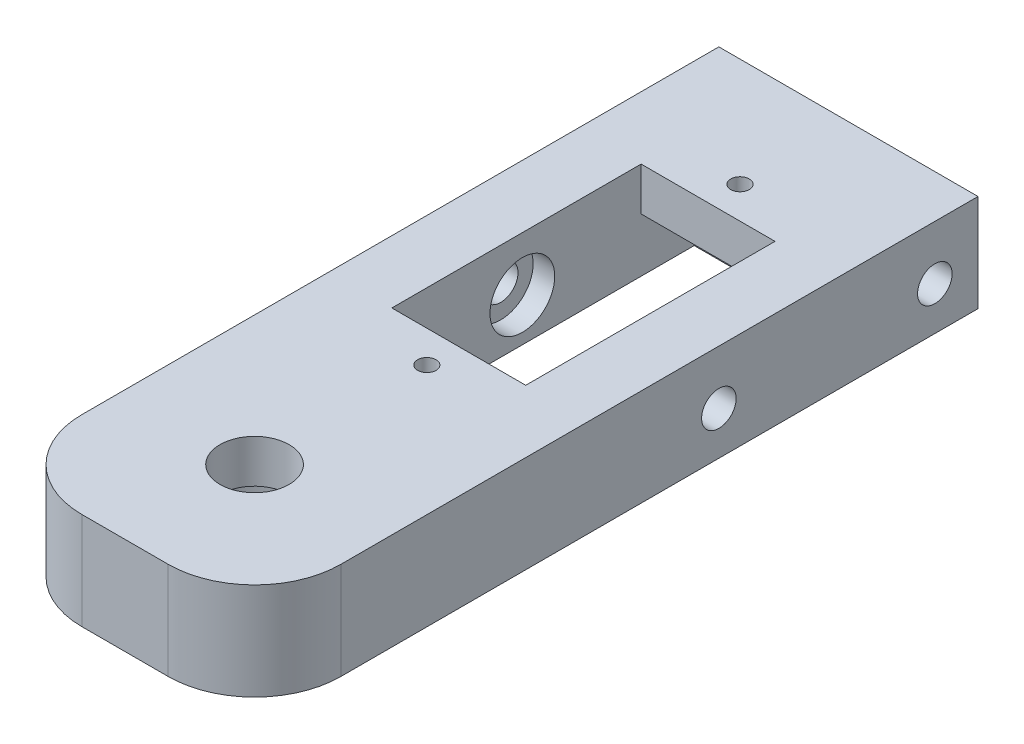
from build123d import *

# Parameters (mm, degrees)
SKETCH_1_W          = 67
SKETCH_1_H          = 9
EXTRUDE_1_DEPTH     = 12
SKETCH_2_R          = 6.7
CUT_EXTRUDE_1_DEPTH = 5
SKETCH_4_R          = 3.2
CUT_EXTRUDE_3_DEPTH = 57.515484604
SKETCH_3_W          = 12.4
SKETCH_3_H          = 23.085257288
CUT_EXTRUDE_2_DEPTH = 58.008771255
SKETCH_5_W          = 12.4
SKETCH_5_H          = 32.914742712
CUT_EXTRUDE_4_DEPTH = 5
SKETCH_6_R          = 0.855484329
CUT_EXTRUDE_5_DEPTH = 57.515484604
FILLET_1_R          = 8
SKETCH_7_R          = 1.6
CUT_EXTRUDE_6_DEPTH = 61.216276869
SKETCH_8_R          = 3
CUT_EXTRUDE_7_DEPTH = 2


with BuildPart() as part:
    # 草图1 → 凸台-拉伸1 (new, symmetric)
    with BuildSketch(Plane(origin=(0, 0, 0), x_dir=(0, 0, -1), z_dir=(1, 0, 0))):
        with Locations((21.5, 0.5)):
            Rectangle(SKETCH_1_W, SKETCH_1_H)
    extrude(amount=EXTRUDE_1_DEPTH, both=True)

    # 草图2 → 切除-拉伸1 (cut)
    with BuildSketch(Plane(origin=(0, -4, 0), x_dir=(1, 0, 0), z_dir=(0, 1, 0))):
        with Locations(Location((0, 0, 0), (0, 0, 270))):
            Circle(SKETCH_2_R)
    extrude(amount=CUT_EXTRUDE_1_DEPTH, mode=Mode.SUBTRACT)

    # 草图4 → 切除-拉伸3 (cut, through all)
    with BuildSketch(Plane.XZ.offset(-1)):
        with Locations(Location((0, 0, 0), (0, 0, 270))):
            Circle(SKETCH_4_R)
    extrude(amount=-CUT_EXTRUDE_3_DEPTH, mode=Mode.SUBTRACT)

    # 草图3 → 切除-拉伸2 (cut, through all)
    with BuildSketch(Plane(origin=(0, 5, 0), x_dir=(1, 0, 0), z_dir=(0, 1, 0))):
        with Locations((0, 30.457371356)):
            Rectangle(SKETCH_3_W, SKETCH_3_H)
    extrude(amount=-CUT_EXTRUDE_2_DEPTH, mode=Mode.SUBTRACT)

    # 草图5 → 切除-拉伸4 (cut)
    with BuildSketch(Plane.XZ.offset(4)):
        with Locations((0, -30.457371356)):
            Rectangle(SKETCH_5_W, SKETCH_5_H)
    extrude(amount=-CUT_EXTRUDE_4_DEPTH, mode=Mode.SUBTRACT)

    # 草图6 → 切除-拉伸5 (cut, through all)
    with BuildSketch(Plane.XZ.offset(-1)):
        with Locations(Location((0, -15.957371356, 0), (0, 0, 270))):
            Circle(SKETCH_6_R)
        with Locations(Location((0, -44.957371356, 0), (0, 0, 90))):
            Circle(SKETCH_6_R)
    extrude(amount=-CUT_EXTRUDE_5_DEPTH, mode=Mode.SUBTRACT)

    # 圆角1
    fillet_1_edges = [part.edges().sort_by_distance(p)[0] for p in [
        (12, 0.5, 12),
        (-12, 0.5, 12),
    ]]
    fillet(fillet_1_edges, radius=FILLET_1_R)

    # 草图7 → 切除-拉伸6 (cut, through all)
    with BuildSketch(Plane(origin=(12, 0, 0), x_dir=(0, 0, -1), z_dir=(1, 0, 0))):
        with Locations((51.001572261, 0)):
            Circle(SKETCH_7_R)
        with Locations((31.001572261, 0)):
            Circle(SKETCH_7_R)
    extrude(amount=-CUT_EXTRUDE_6_DEPTH, mode=Mode.SUBTRACT)

    # 草图8 → 切除-拉伸7 (cut)
    with BuildSketch(Plane(origin=(-6.2, 0, 0), x_dir=(0, 0, -1), z_dir=(1, 0, 0))):
        with Locations((31.001572261, 0)):
            Circle(SKETCH_8_R)
    cut_extrude_7 = extrude(amount=-CUT_EXTRUDE_7_DEPTH, mode=Mode.SUBTRACT)

    # 镜向1: 切除-拉伸7 across plane
    add(cut_extrude_7.mirror(Plane(origin=(0, 0, 0), x_dir=(0, 0, 1), z_dir=(1, 0, 0))), mode=Mode.SUBTRACT)


solid = part.part
